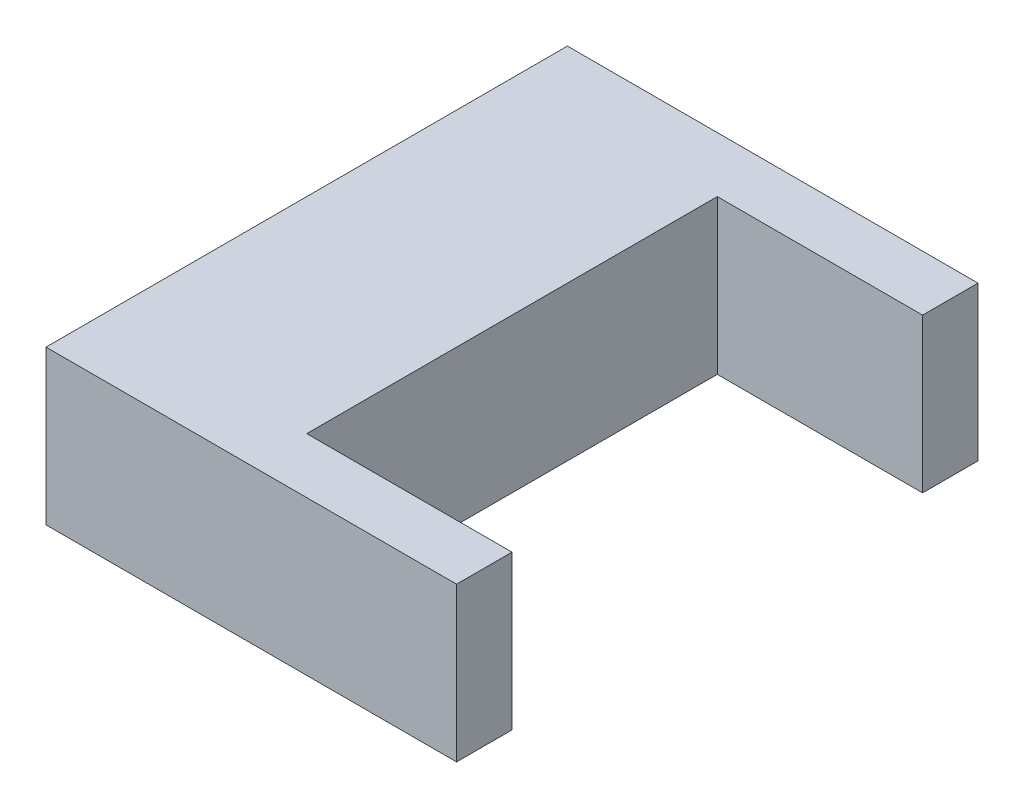
from build123d import *

# Parameters (mm, degrees)
BOSS_EXTRUDE1_DEPTH = 15


with BuildPart() as part:
    # Sketch1 → Boss-Extrude1 (new body)
    with BuildSketch(Plane(origin=(0, 0, 0), x_dir=(1, 0, 0), z_dir=(0, 1, 0))):
        Polygon((40, 20), (40, 25.4), (5, 25.4), (0, 25.4), (0, -25.4), (5, -25.4), (40, -25.4), (40, -20), (20, -20), (20, 20), align=None)
    extrude(amount=BOSS_EXTRUDE1_DEPTH)


solid = part.part
